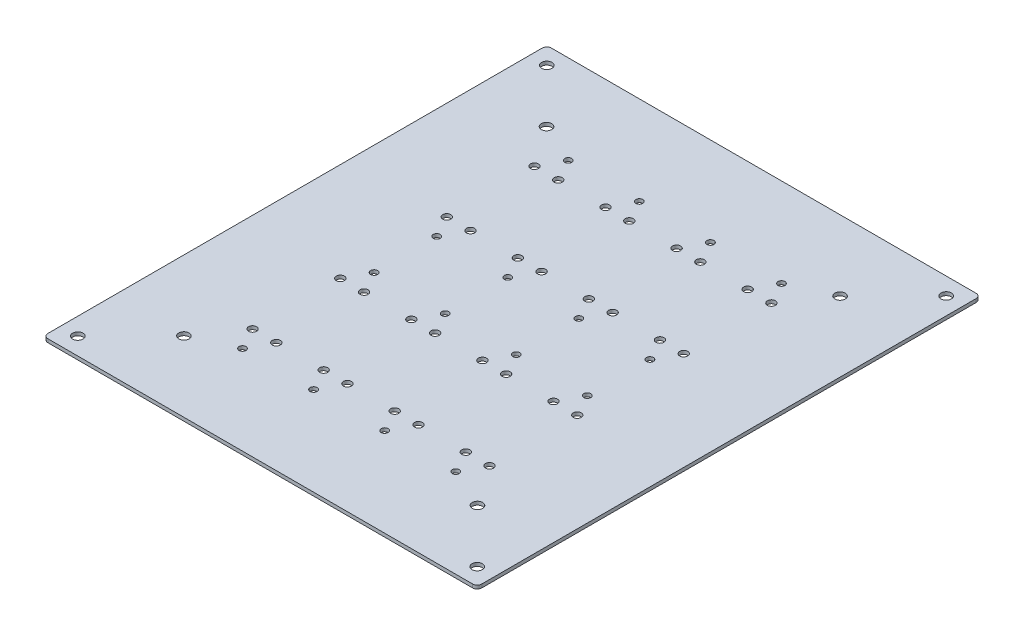
from build123d import *

# Parameters (mm, degrees)
SKETCH1_W               = 188.48
SKETCH1_H               = 218.7
BOSS_EXTRUDE1_DEPTH     = 0.75
CUT_EXTRUDE1_DEPTH      = 145.363603793
CUT_EXTRUDE1_DEPTH_BACK = 145.363603793
SKETCH2_R               = 1.75
SKETCH2_R_2             = 1.5
FILLET1_R               = 2
FILLET2_R               = 2
FILLET3_R               = 2
FILLET4_R               = 2
CUT_EXTRUDE2_DEPTH      = 145.363603793
CUT_EXTRUDE2_DEPTH_BACK = 145.363603793
SKETCH3_R               = 2.25


with BuildPart() as part:
    # Sketch1 → Boss-Extrude1 (new, symmetric)
    with BuildSketch(Plane(origin=(0, 0, 0), x_dir=(1, 0, 0), z_dir=(0, 1, 0))):
        Rectangle(SKETCH1_W, SKETCH1_H)
    extrude(amount=BOSS_EXTRUDE1_DEPTH, both=True)

    # Sketch2 → Cut-Extrude1 (cut, two sides: drawn at the far end of the back side and taken through both)
    with BuildSketch(Plane(origin=(0, 0.75, 0), x_dir=(1, 0, 0), z_dir=(0, 1, 0)).offset(-CUT_EXTRUDE1_DEPTH_BACK)):
        with Locations(Location((-41.15, 61.225, 0), (0, 0, 270))):
            Circle(SKETCH2_R)
        with Locations(Location((-51.46, 61.225, 0), (0, 0, 270))):
            Circle(SKETCH2_R)
        with Locations(Location((-51.46, 23.125, 0), (0, 0, 270))):
            Circle(SKETCH2_R)
        with Locations(Location((-41.15, 23.125, 0), (0, 0, 270))):
            Circle(SKETCH2_R)
        with Locations(Location((-46.305, 70.75, 0), (0, 0, 270))):
            Circle(SKETCH2_R_2)
        with Locations(Location((-46.305, 13.6, 0), (0, 0, 270))):
            Circle(SKETCH2_R_2)
        with Locations(Location((-10.28, 61.225, 0), (0, 0, 270))):
            Circle(SKETCH2_R)
        with Locations(Location((-20.59, 61.225, 0), (0, 0, 270))):
            Circle(SKETCH2_R)
        with Locations(Location((-20.59, 23.125, 0), (0, 0, 270))):
            Circle(SKETCH2_R)
        with Locations(Location((-10.28, 23.125, 0), (0, 0, 270))):
            Circle(SKETCH2_R)
        with Locations(Location((-15.435, 70.75, 0), (0, 0, 270))):
            Circle(SKETCH2_R_2)
        with Locations(Location((-15.435, 13.6, 0), (0, 0, 270))):
            Circle(SKETCH2_R_2)
        with Locations(Location((20.59, 61.225, 0), (0, 0, 270))):
            Circle(SKETCH2_R)
        with Locations(Location((10.28, 61.225, 0), (0, 0, 270))):
            Circle(SKETCH2_R)
        with Locations(Location((10.28, 23.125, 0), (0, 0, 270))):
            Circle(SKETCH2_R)
        with Locations(Location((20.59, 23.125, 0), (0, 0, 270))):
            Circle(SKETCH2_R)
        with Locations(Location((15.435, 70.75, 0), (0, 0, 270))):
            Circle(SKETCH2_R_2)
        with Locations(Location((15.435, 13.6, 0), (0, 0, 270))):
            Circle(SKETCH2_R_2)
        with Locations(Location((51.46, 61.225, 0), (0, 0, 270))):
            Circle(SKETCH2_R)
        with Locations(Location((41.15, 61.225, 0), (0, 0, 270))):
            Circle(SKETCH2_R)
        with Locations(Location((41.15, 23.125, 0), (0, 0, 270))):
            Circle(SKETCH2_R)
        with Locations(Location((51.46, 23.125, 0), (0, 0, 270))):
            Circle(SKETCH2_R)
        with Locations(Location((46.305, 70.75, 0), (0, 0, 270))):
            Circle(SKETCH2_R_2)
        with Locations(Location((46.305, 13.6, 0), (0, 0, 270))):
            Circle(SKETCH2_R_2)
        with Locations(Location((46.305, -13.6, 0), (0, 0, 270))):
            Circle(SKETCH2_R_2)
        with Locations(Location((46.305, -70.75, 0), (0, 0, 270))):
            Circle(SKETCH2_R_2)
        with Locations(Location((51.46, -23.125, 0), (0, 0, 270))):
            Circle(SKETCH2_R)
        with Locations(Location((41.15, -23.125, 0), (0, 0, 270))):
            Circle(SKETCH2_R)
        with Locations(Location((41.15, -61.225, 0), (0, 0, 270))):
            Circle(SKETCH2_R)
        with Locations(Location((51.46, -61.225, 0), (0, 0, 270))):
            Circle(SKETCH2_R)
        with Locations(Location((15.435, -13.6, 0), (0, 0, 270))):
            Circle(SKETCH2_R_2)
        with Locations(Location((15.435, -70.75, 0), (0, 0, 270))):
            Circle(SKETCH2_R_2)
        with Locations(Location((20.59, -23.125, 0), (0, 0, 270))):
            Circle(SKETCH2_R)
        with Locations(Location((10.28, -23.125, 0), (0, 0, 270))):
            Circle(SKETCH2_R)
        with Locations(Location((10.28, -61.225, 0), (0, 0, 270))):
            Circle(SKETCH2_R)
        with Locations(Location((20.59, -61.225, 0), (0, 0, 270))):
            Circle(SKETCH2_R)
        with Locations(Location((-15.435, -13.6, 0), (0, 0, 270))):
            Circle(SKETCH2_R_2)
        with Locations(Location((-15.435, -70.75, 0), (0, 0, 270))):
            Circle(SKETCH2_R_2)
        with Locations(Location((-10.28, -23.125, 0), (0, 0, 270))):
            Circle(SKETCH2_R)
        with Locations(Location((-20.59, -23.125, 0), (0, 0, 270))):
            Circle(SKETCH2_R)
        with Locations(Location((-20.59, -61.225, 0), (0, 0, 270))):
            Circle(SKETCH2_R)
        with Locations(Location((-10.28, -61.225, 0), (0, 0, 270))):
            Circle(SKETCH2_R)
        with Locations(Location((-46.305, -13.6, 0), (0, 0, 270))):
            Circle(SKETCH2_R_2)
        with Locations(Location((-46.305, -70.75, 0), (0, 0, 270))):
            Circle(SKETCH2_R_2)
        with Locations(Location((-41.15, -23.125, 0), (0, 0, 270))):
            Circle(SKETCH2_R)
        with Locations(Location((-51.46, -23.125, 0), (0, 0, 270))):
            Circle(SKETCH2_R)
        with Locations(Location((-51.46, -61.225, 0), (0, 0, 270))):
            Circle(SKETCH2_R)
        with Locations(Location((-41.15, -61.225, 0), (0, 0, 270))):
            Circle(SKETCH2_R)
    extrude(amount=CUT_EXTRUDE1_DEPTH + CUT_EXTRUDE1_DEPTH_BACK, mode=Mode.SUBTRACT)

    # Fillet1
    fillet1_edges = [part.edges().sort_by_distance(p)[0] for p in [
        (-94.24, 0, -109.35),
    ]]
    fillet(fillet1_edges, radius=FILLET1_R)

    # Fillet2
    fillet2_edges = [part.edges().sort_by_distance(p)[0] for p in [
        (-94.24, 0, 109.35),
    ]]
    fillet(fillet2_edges, radius=FILLET2_R)

    # Fillet3
    fillet3_edges = [part.edges().sort_by_distance(p)[0] for p in [
        (94.24, 0, 109.35),
    ]]
    fillet(fillet3_edges, radius=FILLET3_R)

    # Fillet4
    fillet4_edges = [part.edges().sort_by_distance(p)[0] for p in [
        (94.24, 0, -109.35),
    ]]
    fillet(fillet4_edges, radius=FILLET4_R)

    # Sketch3 → Cut-Extrude2 (cut, two sides: drawn at the far end of the back side and taken through both)
    with BuildSketch(Plane(origin=(0, 0.75, 0), x_dir=(1, 0, 0), z_dir=(0, 1, 0)).offset(-CUT_EXTRUDE2_DEPTH_BACK)):
        with Locations(Location((-86.74, 101.85, 0), (0, 0, 270))):
            Circle(SKETCH3_R)
        with Locations(Location((86.74, 101.85, 0), (0, 0, 270))):
            Circle(SKETCH3_R)
        with Locations(Location((86.74, -101.85, 0), (0, 0, 270))):
            Circle(SKETCH3_R)
        with Locations(Location((-86.74, -101.85, 0), (0, 0, 270))):
            Circle(SKETCH3_R)
        with Locations(Location((-63.75, 78.75, 0), (0, 0, 270))):
            Circle(SKETCH3_R)
        with Locations(Location((63.75, 78.75, 0), (0, 0, 270))):
            Circle(SKETCH3_R)
        with Locations(Location((63.75, -78.75, 0), (0, 0, 270))):
            Circle(SKETCH3_R)
        with Locations(Location((-63.75, -78.75, 0), (0, 0, 270))):
            Circle(SKETCH3_R)
    extrude(amount=CUT_EXTRUDE2_DEPTH + CUT_EXTRUDE2_DEPTH_BACK, mode=Mode.SUBTRACT)


solid = part.part
